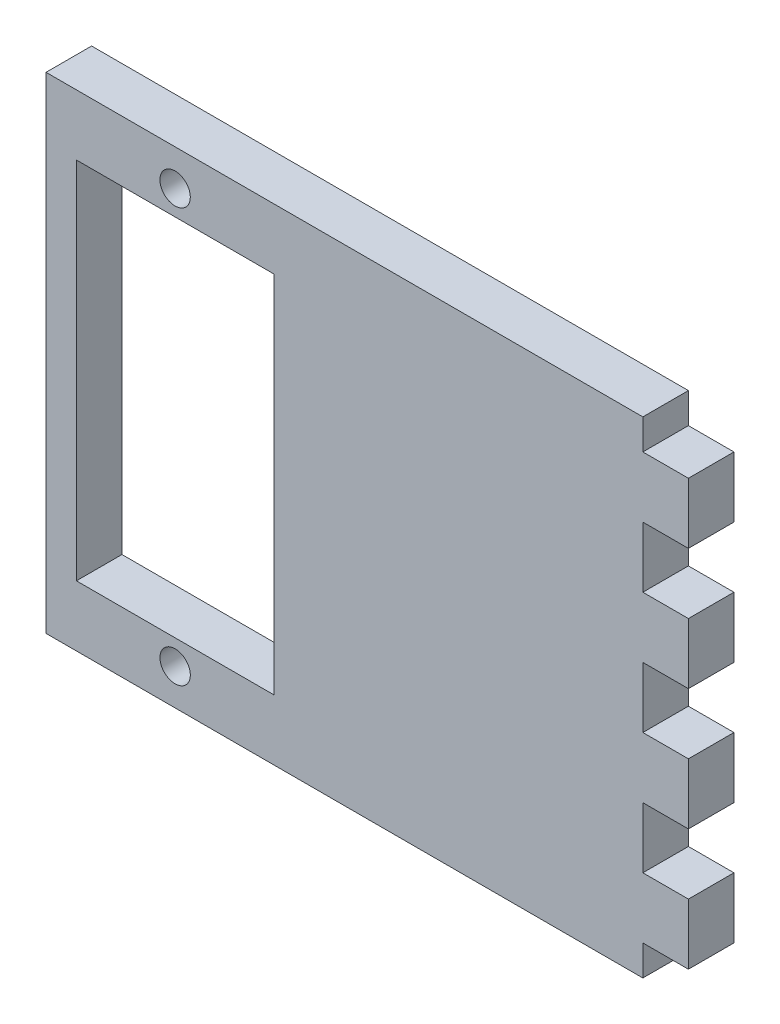
from build123d import *

# Parameters (mm, degrees)
SKETCH1_R           = 1
SKETCH1_W           = 13
SKETCH1_H           = 24
BOSS_EXTRUDE1_DEPTH = 3


with BuildPart() as part:
    # Sketch1 → Boss-Extrude1 (new body)
    with BuildSketch(Plane.XY):
        Polygon((30.8, 14), (33.8, 14), (33.8, 10), (30.8, 10), (30.8, 6), (33.8, 6), (33.8, 2), (30.8, 2), (30.8, -2), (33.8, -2), (33.8, -6), (30.8, -6), (30.8, -10), (33.8, -10), (33.8, -14), (30.8, -14), (30.8, -16), (-8.5, -16), (-8.5, 16), (30.8, 16), align=None)
        with Locations((0, 13.625)):
            Circle(SKETCH1_R, mode=Mode.SUBTRACT)
        with Locations(Location((0, -13.625, 0), (0, 0, 180))):
            Circle(SKETCH1_R, mode=Mode.SUBTRACT)
        Rectangle(SKETCH1_W, SKETCH1_H, mode=Mode.SUBTRACT)
    extrude(amount=BOSS_EXTRUDE1_DEPTH)


solid = part.part
